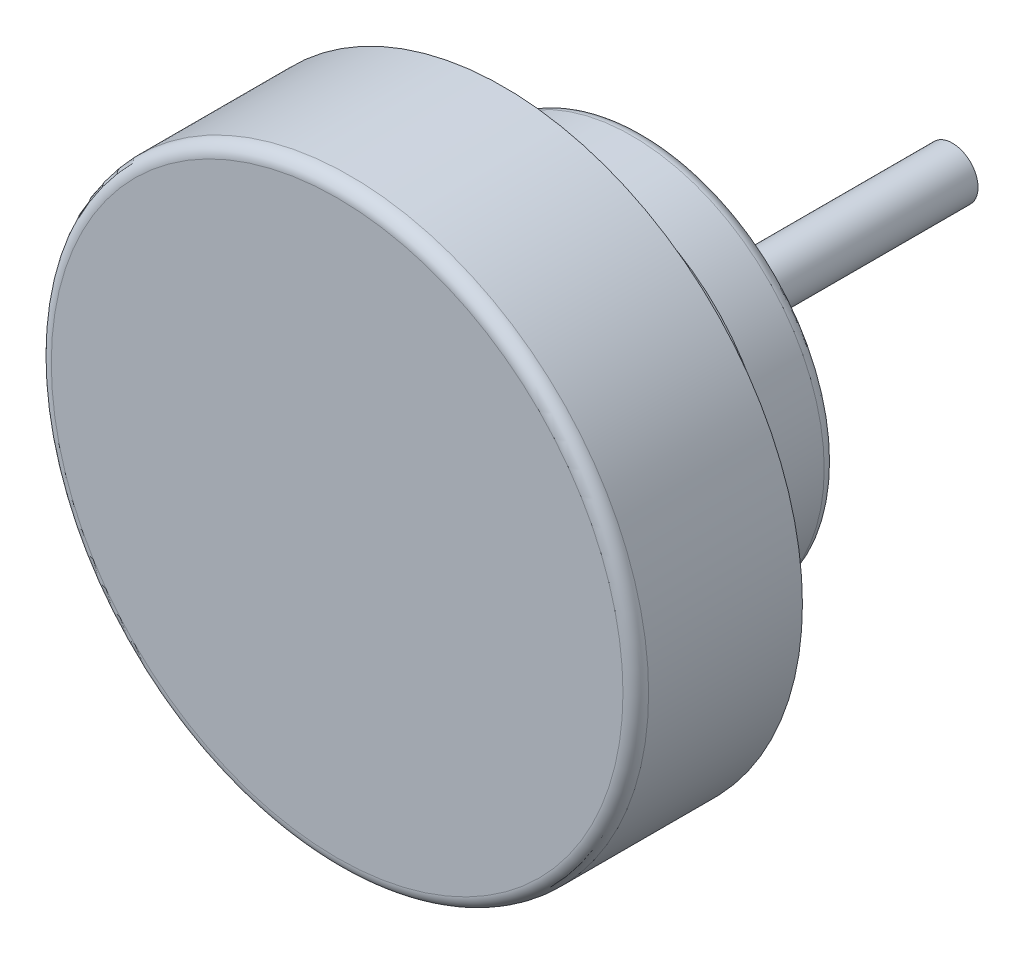
from build123d import *

# Parameters (mm, degrees)
SKETCH1_R           = 11.65
BOSS_EXTRUDE1_DEPTH = 6.5
FILLET1_R           = 0.5
SKETCH2_R           = 3.25
BOSS_EXTRUDE2_DEPTH = 3
SKETCH3_R           = 7.5
BOSS_EXTRUDE3_DEPTH = 2.5
FILLET2_R           = 0.5
SKETCH4_R           = 1
BOSS_EXTRUDE4_DEPTH = 12
CUT_EXTRUDE1_REACH  = 22.382
SKETCH5_R           = 1


with BuildPart() as part:
    # Sketch1 → Boss-Extrude1 (new body)
    with BuildSketch(Plane.XY):
        with Locations(Location((0, 0, 0), (0, 0, 180))):
            Circle(SKETCH1_R)
    extrude(amount=BOSS_EXTRUDE1_DEPTH)

    # Fillet1
    fillet1_edges = [part.edges().sort_by_distance(p)[0] for p in [
        (11.65, 0, 6.5),
    ]]
    fillet(fillet1_edges, radius=FILLET1_R)

    # Sketch2 → Boss-Extrude2 (add)
    with BuildSketch(Plane(origin=(0, 0, 0), x_dir=(-1, 0, 0), z_dir=(0, 0, -1))):
        Circle(SKETCH2_R)
    extrude(amount=BOSS_EXTRUDE2_DEPTH)

    # Sketch3 → Boss-Extrude3 (add)
    with BuildSketch(Plane(origin=(0, 0, -3), x_dir=(-1, 0, 0), z_dir=(0, 0, -1))):
        Circle(SKETCH3_R)
    extrude(amount=BOSS_EXTRUDE3_DEPTH)

    # Fillet2
    fillet2_edges = [part.edges().sort_by_distance(p)[0] for p in [
        (7.5, 0, -5.5),
    ]]
    fillet(fillet2_edges, radius=FILLET2_R)

    # Sketch4 → Boss-Extrude4 (add)
    with BuildSketch(Plane(origin=(0, 0, -5.5), x_dir=(-1, 0, 0), z_dir=(0, 0, -1))):
        Circle(SKETCH4_R)
    extrude(amount=BOSS_EXTRUDE4_DEPTH)

    # Sketch5 → Cut-Extrude1 (cut, up to next)
    with BuildSketch(Plane(origin=(0, 0, -5.5), x_dir=(-1, 0, 0), z_dir=(0, 0, -1)), mode=Mode.PRIVATE) as cut_extrude1_sk1:
        with Locations((4.54663337, -2.625)):
            Circle(SKETCH5_R)
    cut_extrude1_tool1 = extrude(cut_extrude1_sk1.sketch, amount=-CUT_EXTRUDE1_REACH, mode=Mode.PRIVATE) & part.part
    # Sketch5 → Cut-Extrude1 (cut, up to next)
    with BuildSketch(Plane(origin=(0, 0, -5.5), x_dir=(-1, 0, 0), z_dir=(0, 0, -1)), mode=Mode.PRIVATE) as cut_extrude1_sk2:
        with Locations((0, 5.25)):
            Circle(SKETCH5_R)
    cut_extrude1_tool2 = extrude(cut_extrude1_sk2.sketch, amount=-CUT_EXTRUDE1_REACH, mode=Mode.PRIVATE) & part.part
    # Sketch5 → Cut-Extrude1 (cut, up to next)
    with BuildSketch(Plane(origin=(0, 0, -5.5), x_dir=(-1, 0, 0), z_dir=(0, 0, -1)), mode=Mode.PRIVATE) as cut_extrude1_sk3:
        with Locations((-4.54663337, -2.625)):
            Circle(SKETCH5_R)
    cut_extrude1_tool3 = extrude(cut_extrude1_sk3.sketch, amount=-CUT_EXTRUDE1_REACH, mode=Mode.PRIVATE) & part.part
    add(cut_extrude1_tool1.solids().sort_by_distance((-4.546633, -2.625, -5.5))[0], mode=Mode.SUBTRACT)
    add(cut_extrude1_tool2.solids().sort_by_distance((0, 5.25, -5.5))[0], mode=Mode.SUBTRACT)
    add(cut_extrude1_tool3.solids().sort_by_distance((4.546633, -2.625, -5.5))[0], mode=Mode.SUBTRACT)


solid = part.part
